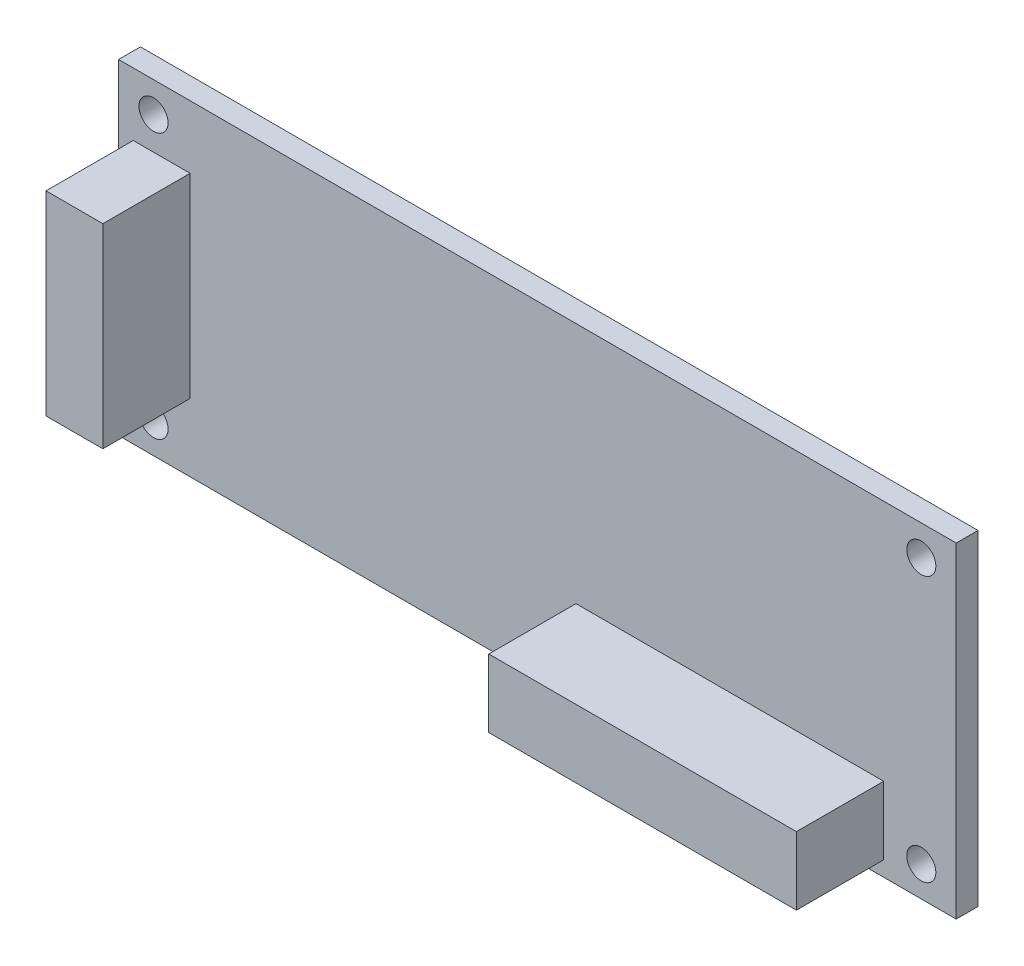
from build123d import *

# Parameters (mm, degrees)
SKETCH1_W               = 91.44
SKETCH1_H               = 35.56
BOSS_EXTRUDE1_DEPTH     = 2.38125
SKETCH2_R               = 1.5875
CUT_EXTRUDE1_DEPTH      = 50.113309312
MIRROR2_COPY_1_SKETCH_R = 1.5875
MIRROR2_COPY_1_DEPTH    = 50.113309312
SKETCH3_W               = 6.208251033
SKETCH3_H               = 21.285432112
SKETCH3_W_2             = 33.591072552
SKETCH3_H_2             = 7.427728914
BOSS_EXTRUDE2_DEPTH     = 9.525


with BuildPart() as part:
    # Sketch1 → Boss-Extrude1 (new body)
    with BuildSketch(Plane.XY):
        Rectangle(SKETCH1_W, SKETCH1_H)
    extrude(amount=BOSS_EXTRUDE1_DEPTH)

    # Sketch2 → Cut-Extrude1 (cut, through all)
    with BuildSketch(Plane.XY.offset(2.38125)):
        with Locations((-41.91, 14.478)):
            Circle(SKETCH2_R)
    cut_extrude1 = extrude(amount=-CUT_EXTRUDE1_DEPTH, mode=Mode.SUBTRACT)

    # Mirror1: Cut-Extrude1 across plane
    add(cut_extrude1.mirror(Plane(origin=(0, 0, 0), x_dir=(0, 0, 1), z_dir=(1, 0, 0))), mode=Mode.SUBTRACT)

    # Mirror2: Cut-Extrude1 across plane
    add(cut_extrude1.mirror(Plane.ZX), mode=Mode.SUBTRACT)

    # Mirror2 copy 1 sketch → Mirror2 copy 1 (cut, through all)
    with BuildSketch(Plane(origin=(0, 0, 2.38125), x_dir=(-1, 0, 0), z_dir=(0, 0, 1))):
        with Locations((-41.91, 14.478)):
            Circle(MIRROR2_COPY_1_SKETCH_R)
    extrude(amount=-MIRROR2_COPY_1_DEPTH, mode=Mode.SUBTRACT)

    # Sketch3 → Boss-Extrude2 (add)
    with BuildSketch(Plane.XY.offset(2.38125)):
        with Locations((-41.018801466, 0.277154064)):
            Rectangle(SKETCH3_W, SKETCH3_H)
        with Locations((21.008278048, -12.416502065)):
            Rectangle(SKETCH3_W_2, SKETCH3_H_2)
    extrude(amount=BOSS_EXTRUDE2_DEPTH)


solid = part.part
